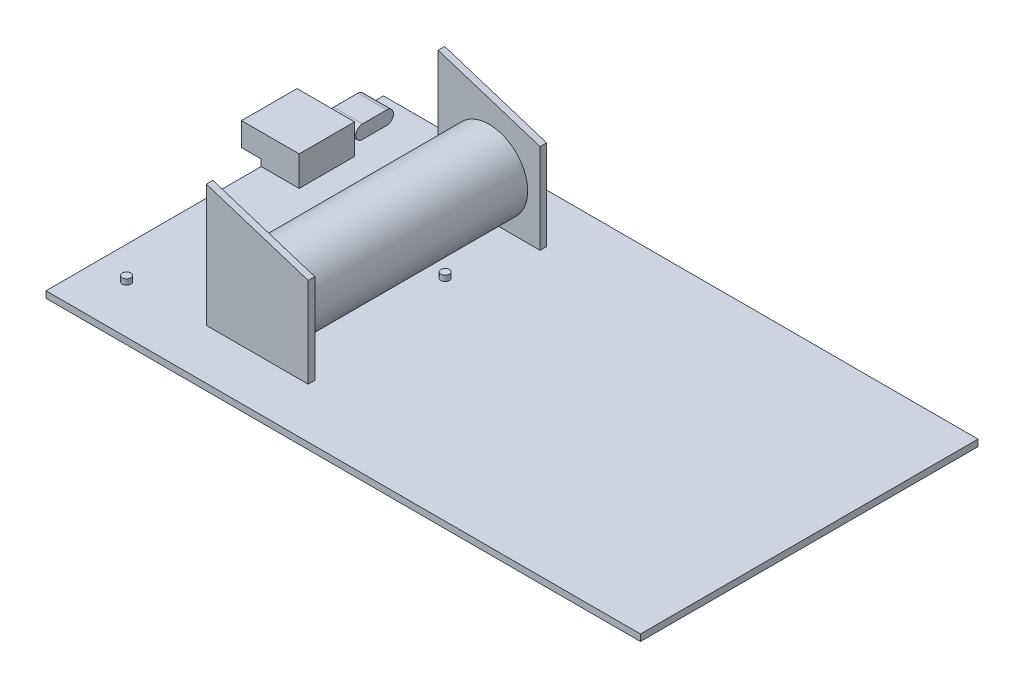
from build123d import *

# Parameters (mm, degrees)
SKETCH1_W                = 140.9
SKETCH1_H                = 80
PCB_DEPTH                = 1.55
BODYC_DEPTH              = 0.4
BODYC_DEPTH_BACK         = 6.45
BOSS_EXTRUDE4_DEPTH      = 7.1
BOSS_EXTRUDE4_DEPTH_BACK = 1.55
SKETCH4_W                = 13.65
SKETCH4_H                = 13.15
SKETCH5_W                = 4.65
SKETCH5_H                = 3.1
CUT_EXTRUDE3_DEPTH       = 14.1
SKETCH11_W               = 24.15
SKETCH11_H               = 1.55
BOSS_EXTRUDE8_DEPTH      = 29
SKETCH7_W                = 24.15
SKETCH7_H                = 1.55
BOSS_EXTRUDE5_DEPTH      = 29
CUT_EXTRUDE4_DEPTH       = 89
SKETCH12_R               = 9.15
BATTERY_DEPTH            = 54
SKETCH13_R               = 1
BUTTON_DEPTH             = 1.3
SKETCH14_R               = 1
RESET_DEPTH              = 1.3


with BuildPart() as part:
    # Sketch1 → PCB (new body)
    with BuildSketch(Plane(origin=(0, 0, 0), x_dir=(1, 0, 0), z_dir=(0, 1, 0))):
        Rectangle(SKETCH1_W, SKETCH1_H)
    extrude(amount=PCB_DEPTH)

    # Sketch3 → bodyC (add, two sides: drawn at the far end of the back side and taken through both)
    with BuildSketch(Plane.ZY.offset(70.45).offset(-BODYC_DEPTH_BACK)):
        with BuildLine():
            Line((-34.3, 4.75), (-28.56, 4.75))
            ThreePointArc((-28.56, 4.75), (-26.96, 3.15), (-28.56, 1.55))
            Line((-28.56, 1.55), (-34.3, 1.55))
            ThreePointArc((-34.3, 1.55), (-35.9, 3.15), (-34.3, 4.75))
        make_face()
    extrude(amount=BODYC_DEPTH + BODYC_DEPTH_BACK)

    # Sketch4 → Boss-Extrude4 (add, two sides: drawn at the far end of the back side and taken through both)
    with BuildSketch(Plane(origin=(0, 1.55, 0), x_dir=(1, 0, 0), z_dir=(0, 1, 0)).offset(-BOSS_EXTRUDE4_DEPTH_BACK)):
        with Locations((-68.275, 17.575)):
            Rectangle(SKETCH4_W, SKETCH4_H)
    extrude(amount=BOSS_EXTRUDE4_DEPTH + BOSS_EXTRUDE4_DEPTH_BACK)

    # Sketch5 → Cut-Extrude3 (cut)
    with BuildSketch(Plane.XY.offset(-11)):
        with Locations((-72.775, 1.55)):
            Rectangle(SKETCH5_W, SKETCH5_H)
    extrude(amount=-CUT_EXTRUDE3_DEPTH, mode=Mode.SUBTRACT)

    # Sketch11 → Boss-Extrude8 (add)
    with BuildSketch(Plane(origin=(0, 1.55, 0), x_dir=(1, 0, 0), z_dir=(0, 1, 0))):
        with Locations((-32.275, 27.625)):
            Rectangle(SKETCH11_W, SKETCH11_H)
    extrude(amount=BOSS_EXTRUDE8_DEPTH)

    # Sketch7 → Boss-Extrude5 (add)
    with BuildSketch(Plane(origin=(0, 1.55, 0), x_dir=(1, 0, 0), z_dir=(0, 1, 0))):
        with Locations((-32.275, -27.325)):
            Rectangle(SKETCH7_W, SKETCH7_H)
    extrude(amount=BOSS_EXTRUDE5_DEPTH)

    # Sketch8 → Cut-Extrude4 (cut)
    with BuildSketch(Plane.XY.offset(28.1)):
        Polygon((-44.35, 30.55), (-20.2, 22.85), (-20.2, 30.55), align=None)
    extrude(amount=-CUT_EXTRUDE4_DEPTH, mode=Mode.SUBTRACT)

    # Sketch12 → Battery (add)
    with BuildSketch(Plane.XY.offset(-26.85)):
        with Locations(Location((-32.275, 12.25, 0), (0, 0, 180))):
            Circle(SKETCH12_R)
    extrude(amount=BATTERY_DEPTH)

    # Sketch13 → Button (add)
    with BuildSketch(Plane(origin=(0, 1.55, 0), x_dir=(1, 0, 0), z_dir=(0, 1, 0))):
        with Locations(Location((-62.75, -28.6, 0), (0, 0, 90))):
            Circle(SKETCH13_R)
    extrude(amount=BUTTON_DEPTH)

    # Sketch14 → Reset (add)
    with BuildSketch(Plane(origin=(0, 1.55, 0), x_dir=(1, 0, 0), z_dir=(0, 1, 0))):
        with Locations(Location((-25.75, 9.9, 0), (0, 0, 90))):
            Circle(SKETCH14_R)
    extrude(amount=RESET_DEPTH)


solid = part.part
